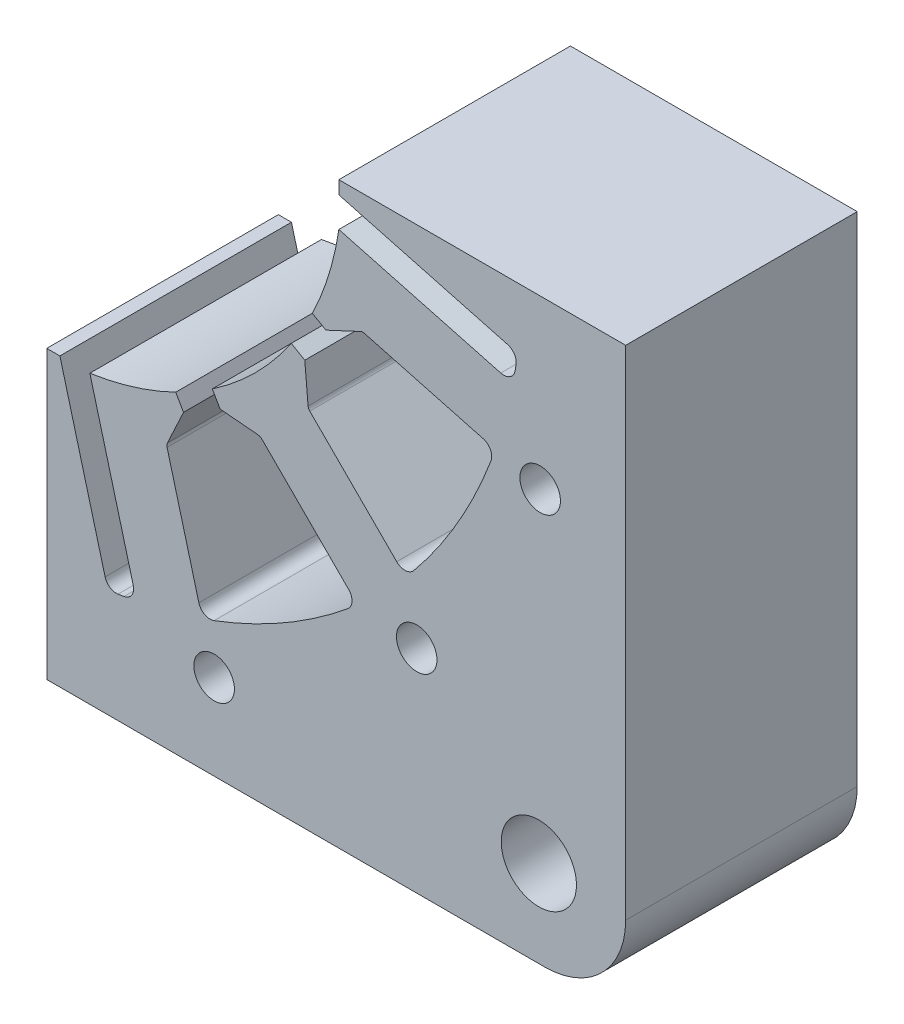
from build123d import *

# Parameters (mm, degrees)
SKETCH1_W                              = 100
SKETCH1_H                              = 100
SKETCH1_R                              = 25.5
LAMINATION_EXTRUCTION_DEPTH            = 20
SLOT_CUT_DEPTH                         = 74.484692283
SLOT_FILLET_TOP_R                      = 1
SLOT_FILLET_BOTTOM_R                   = 0.5
SLOT_DUPLICATE_COUNT                   = 12
SLOT_FILLET_TOP_OF_SLOT_DUPLICATE_R    = 1
SLOT_FILLET_BOTTOM_OF_SLOT_DUPLICATE_R = 0.5
SKETCH3_R                              = 3.25
BOLT_HOLE_CUT_DEPTH                    = 74.484692283
CORNER_FILLET_R                        = 7
SKETCH4_W                              = 50
SKETCH4_H                              = 100
CUT_EXTRUDE1_DEPTH                     = 74.484692283
SKETCH5_W                              = 50
SKETCH5_H                              = 50
CUT_EXTRUDE2_DEPTH                     = 74.484692283
SKETCH6_R                              = 1.75
CUT_EXTRUDE3_DEPTH                     = 74.484692283
CUT_EXTRUDE4_DEPTH                     = 74.484692283
BOSS_EXTRUDE1_START                    = -20
BOSS_EXTRUDE1_DEPTH                    = 20
FILLET1_R                              = 1


with BuildPart() as part:
    # Sketch1 → Lamination Extruction (new body)
    with BuildSketch(Plane.XY):
        Rectangle(SKETCH1_W, SKETCH1_H)
        Circle(SKETCH1_R, mode=Mode.SUBTRACT)
    extrude(amount=LAMINATION_EXTRUCTION_DEPTH)

    # Sketch2 → Slot Cut (cut, through all)
    with BuildSketch(Plane.XY.offset(20)):
        with BuildLine():
            Line((4.673479277, 28.779136449), (7.75, 40.260868098))
            ThreePointArc((7.75, 40.260868098), (0, 41), (-7.75, 40.260868098))
            Line((-7.75, 40.260868098), (-4.673479277, 28.779136449))
            Line((-4.673479277, 28.779136449), (-1.825, 26.784609787))
            Line((-1.825, 26.784609787), (-1.825, 25.434609787))
            ThreePointArc((-1.825, 25.434609787), (0, 25.5), (1.825, 25.434609787))
            Line((1.825, 25.434609787), (1.825, 26.784609787))
            Line((1.825, 26.784609787), (4.673479277, 28.779136449))
        make_face()
    slot_cut = extrude(amount=-SLOT_CUT_DEPTH, mode=Mode.SUBTRACT)

    # Slot Fillet Top
    slot_fillet_top_edges = [part.edges().sort_by_distance(p)[0] for p in [
        (-7.75, 40.260868098, 10),
        (7.75, 40.260868098, 10),
    ]]
    fillet(slot_fillet_top_edges, radius=SLOT_FILLET_TOP_R)

    # Slot Fillet Bottom
    slot_fillet_bottom_edges = [part.edges().sort_by_distance(p)[0] for p in [
        (4.673479277, 28.779136449, 10),
        (-4.673479277, 28.779136449, 10),
    ]]
    fillet(slot_fillet_bottom_edges, radius=SLOT_FILLET_BOTTOM_R)

    # Slot Duplicate: Slot Cut ×12 about axis
    slot_duplicate_axis = Axis((0, 0, 0), (0, 0, 1))
    for i in range(1, SLOT_DUPLICATE_COUNT):
        add(slot_cut.rotate(slot_duplicate_axis, i * 360 / SLOT_DUPLICATE_COUNT), mode=Mode.SUBTRACT)

    # Slot Fillet Top of Slot Duplicate
    slot_fillet_top_of_slot_duplicate_edges = [part.edges().sort_by_distance(p)[0] for p in [
        (-26.842130928, 30.991934551, 10),
        (-13.41873717, 38.741934551, 10),
        (-38.741934551, 13.41873717, 10),
        (-30.991934551, 26.842130928, 10),
        (-40.260868098, -7.75, 10),
        (-40.260868098, 7.75, 10),
        (-30.991934551, -26.842130928, 10),
        (-38.741934551, -13.41873717, 10),
        (-13.41873717, -38.741934551, 10),
        (-26.842130928, -30.991934551, 10),
        (7.75, -40.260868098, 10),
        (-7.75, -40.260868098, 10),
        (26.842130928, -30.991934551, 10),
        (13.41873717, -38.741934551, 10),
        (38.741934551, -13.41873717, 10),
        (30.991934551, -26.842130928, 10),
        (40.260868098, 7.75, 10),
        (40.260868098, -7.75, 10),
        (30.991934551, 26.842130928, 10),
        (38.741934551, 13.41873717, 10),
        (13.41873717, 38.741934551, 10),
        (26.842130928, 30.991934551, 10),
    ]]
    fillet(slot_fillet_top_of_slot_duplicate_edges, radius=SLOT_FILLET_TOP_OF_SLOT_DUPLICATE_R)

    # Slot Fillet Bottom of Slot Duplicate
    slot_fillet_bottom_of_slot_duplicate_edges = [part.edges().sort_by_distance(p)[0] for p in [
        (-10.342216447, 27.260202902, 10),
        (-18.436920002, 22.586723625, 10),
        (-22.586723625, 18.436920002, 10),
        (-27.260202902, 10.342216447, 10),
        (-28.779136449, 4.673479277, 10),
        (-28.779136449, -4.673479277, 10),
        (-27.260202902, -10.342216447, 10),
        (-22.586723625, -18.436920002, 10),
        (-18.436920002, -22.586723625, 10),
        (-10.342216447, -27.260202902, 10),
        (-4.673479277, -28.779136449, 10),
        (4.673479277, -28.779136449, 10),
        (10.342216447, -27.260202902, 10),
        (18.436920002, -22.586723625, 10),
        (22.586723625, -18.436920002, 10),
        (27.260202902, -10.342216447, 10),
        (28.779136449, -4.673479277, 10),
        (28.779136449, 4.673479277, 10),
        (27.260202902, 10.342216447, 10),
        (22.586723625, 18.436920002, 10),
        (18.436920002, 22.586723625, 10),
        (10.342216447, 27.260202902, 10),
    ]]
    fillet(slot_fillet_bottom_of_slot_duplicate_edges, radius=SLOT_FILLET_BOTTOM_OF_SLOT_DUPLICATE_R)

    # Sketch3 → Bolt Hole Cut (cut, through all)
    with BuildSketch(Plane.XY.offset(20)):
        with Locations((-42.5, 42.5)):
            Circle(SKETCH3_R)
        with Locations((42.5, 42.5)):
            Circle(SKETCH3_R)
        with Locations((42.5, -42.5)):
            Circle(SKETCH3_R)
        with Locations((-42.5, -42.5)):
            Circle(SKETCH3_R)
    extrude(amount=-BOLT_HOLE_CUT_DEPTH, mode=Mode.SUBTRACT)

    # Corner Fillet
    corner_fillet_edges = [part.edges().sort_by_distance(p)[0] for p in [
        (-50, 50, 10),
        (50, 50, 10),
        (50, -50, 10),
        (-50, -50, 10),
    ]]
    fillet(corner_fillet_edges, radius=CORNER_FILLET_R)

    # Sketch4 → Cut-Extrude1 (cut, through all)
    with BuildSketch(Plane.XY.offset(20)):
        with Locations((-25, 0)):
            Rectangle(SKETCH4_W, SKETCH4_H)
    extrude(amount=-CUT_EXTRUDE1_DEPTH, mode=Mode.SUBTRACT)

    # Sketch5 → Cut-Extrude2 (cut, through all)
    with BuildSketch(Plane.XY.offset(20)):
        with Locations((25, 25)):
            Rectangle(SKETCH5_W, SKETCH5_H)
    extrude(amount=-CUT_EXTRUDE2_DEPTH, mode=Mode.SUBTRACT)

    # Sketch6 → Cut-Extrude3 (cut, through all)
    with BuildSketch(Plane.XY.offset(20)):
        with Locations((42.614685392, -14.45643763)):
            Circle(SKETCH6_R)
        with Locations((14.45643763, -42.614685392)):
            Circle(SKETCH6_R)
        with Locations((31.95356776, -31.685477863)):
            Circle(SKETCH6_R)
    extrude(amount=-CUT_EXTRUDE3_DEPTH, mode=Mode.SUBTRACT)

    # Sketch7 → Cut-Extrude4 (cut, through all)
    with BuildSketch(Plane(origin=(0, 0, 0), x_dir=(-1, 0, 0), z_dir=(0, 0, -1))):
        Polygon((-7.468192794, -39.209149287), (-3.721674491, -25.22695263), (0, -25.22695263), (0, -41), align=None)
        Polygon((-39.209149287, -7.468192794), (-25.22695263, -3.721674491), (-25.22695263, 0), (-41, 0), align=None)
    extrude(amount=-CUT_EXTRUDE4_DEPTH, mode=Mode.SUBTRACT)

    # Sketch8 → Boss-Extrude1 (add)
    with BuildSketch(Plane(origin=(0, 0, 0), x_dir=(-1, 0, 0), z_dir=(0, 0, -1)).offset(BOSS_EXTRUDE1_START)):
        with BuildLine():
            Line((-25.22695263, -1.13348404), (-40.660054712, -5.26877128))
            ThreePointArc((-40.660054712, -5.26877128), (-40.914925414, -2.63986333), (-41, 0))
            Line((-41, 0), (-25.22695263, 0))
            Line((-25.22695263, 0), (-25.22695263, -1.13348404))
        make_face()
        with BuildLine():
            Line((0, -41), (0, -25.22695263))
            Line((0, -25.22695263), (-1.13348404, -25.22695263))
            Line((-1.13348404, -25.22695263), (-5.26877128, -40.660054712))
            ThreePointArc((-5.26877128, -40.660054712), (-2.63986333, -40.914925414), (0, -41))
        make_face()
    extrude(amount=BOSS_EXTRUDE1_DEPTH)

    # Fillet1
    fillet1_edges = [part.edges().sort_by_distance(p)[0] for p in [
        (40.660054712, -5.26877128, 10),
        (5.26877128, -40.660054712, 10),
    ]]
    fillet(fillet1_edges, radius=FILLET1_R)


solid = part.part
